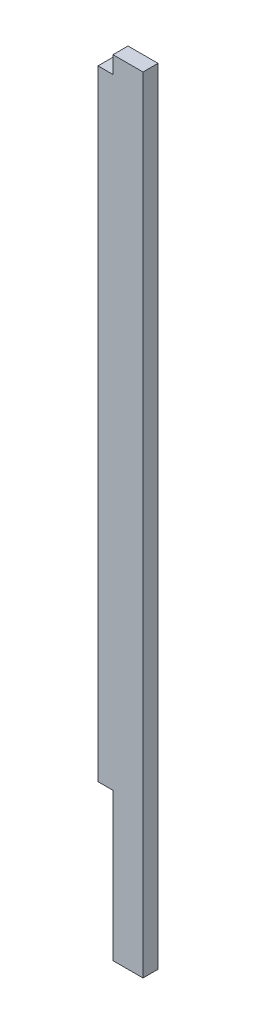
from build123d import *

# Parameters (mm, degrees)
BOSS_EXTRUDE1_DEPTH = 5.4102
SKETCH2_W           = 10.8204
SKETCH2_H           = 40.64
BOSS_EXTRUDE2_DEPTH = 5.4102


with BuildPart() as part:
    # Sketch1 → Boss-Extrude1 (new body)
    with BuildSketch(Plane.XY):
        Polygon((-2.7051, -108.6104), (-2.7051, -121.158), (8.1153, -121.158), (8.1153, 121.158), (-2.7051, 121.158), (-2.7051, 114.9604), (-8.1153, 114.9604), (-8.1153, -108.6104), align=None)
    extrude(amount=BOSS_EXTRUDE1_DEPTH)

    # Sketch2 → Boss-Extrude2 (add)
    with BuildSketch(Plane.XY.offset(5.4102)):
        with Locations((2.7051, -141.478)):
            Rectangle(SKETCH2_W, SKETCH2_H)
    extrude(amount=-BOSS_EXTRUDE2_DEPTH)


solid = part.part
